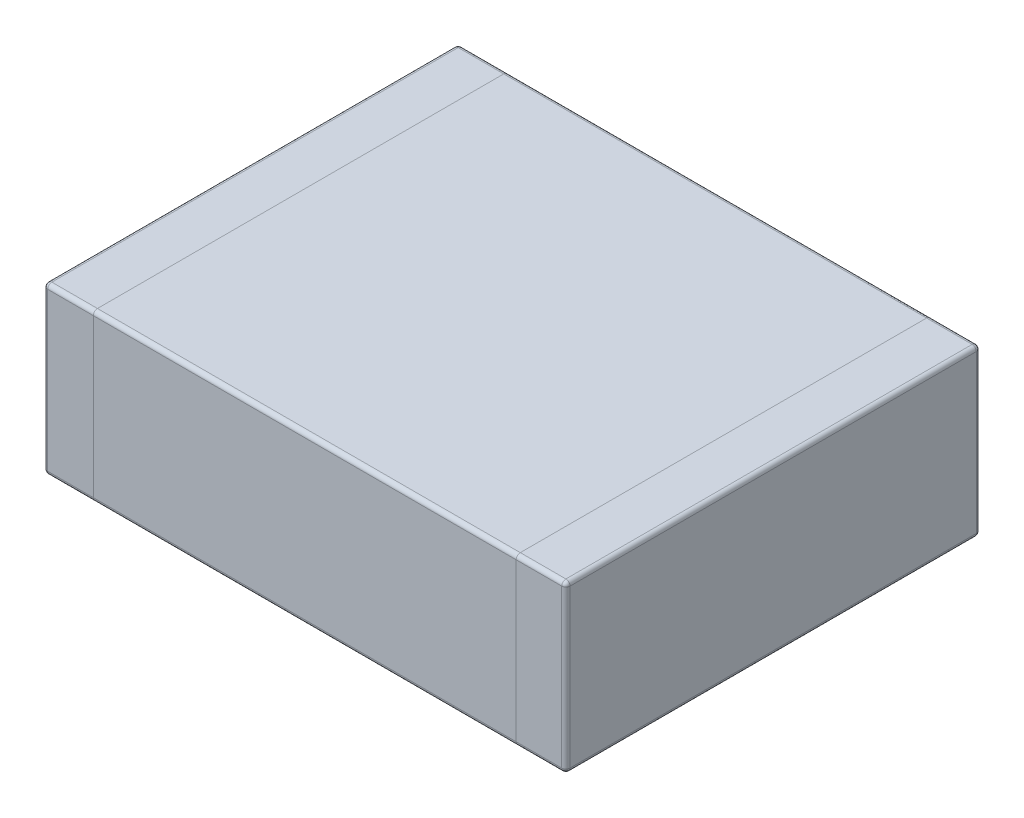
from build123d import *

# Parameters (mm, degrees)
SKETCH1_W      = 6.3
SKETCH1_H      = 5
EXTRUDE1_DEPTH = 2
FILLET1_R      = 0.05


with BuildPart() as part:
    # Sketch1 → Extrude1 (new body)
    with BuildSketch(Plane(origin=(0, 0, 0), x_dir=(1, 0, 0), z_dir=(0, 1, 0))):
        Rectangle(SKETCH1_W, SKETCH1_H)
    extrude(amount=EXTRUDE1_DEPTH)

    # Fillet1
    fillet1_edges = [part.edges().sort_by_distance(p)[0] for p in [
        (-3.15, 2, 0),
        (0, 2, 2.5),
        (3.15, 2, 0),
        (0, 0, 2.5),
        (-3.15, 0, 0),
        (0, 0, -2.5),
        (3.15, 0, 0),
        (0, 2, -2.5),
        (3.15, 1, 2.5),
        (-3.15, 1, 2.5),
        (-3.15, 1, -2.5),
        (3.15, 1, -2.5),
    ]]
    fillet(fillet1_edges, radius=FILLET1_R)


solid = part.part
